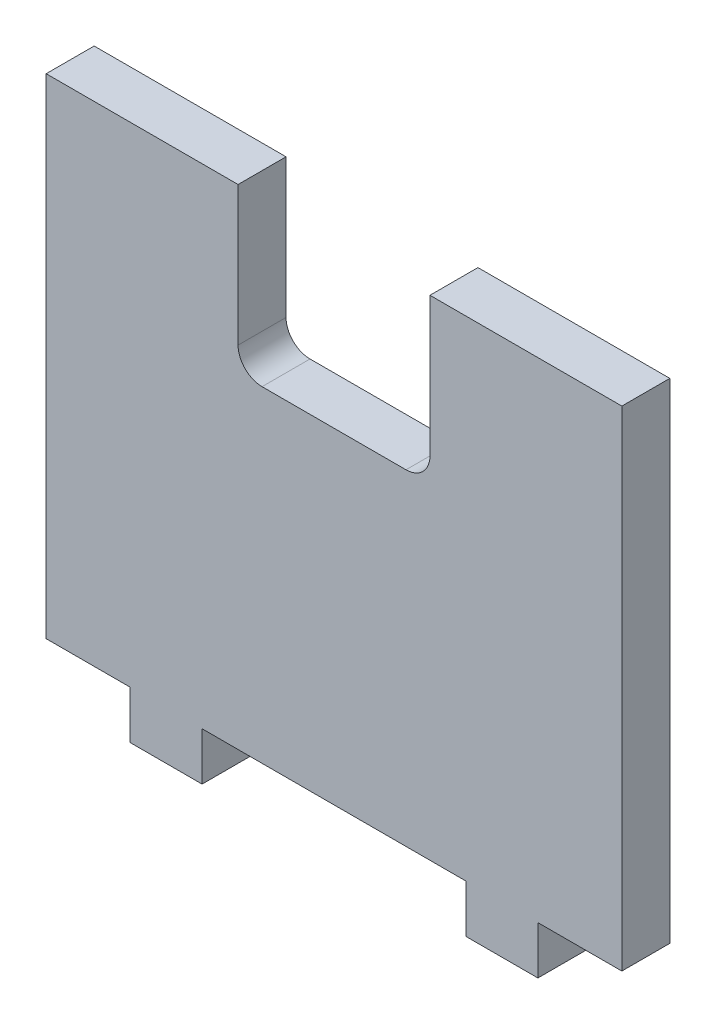
from build123d import *

# Parameters (mm, degrees)
EXTRUDE1_DEPTH     = 12.7
SKETCH2_W          = 50.8
SKETCH2_H          = 43.18
CUT_EXTRUDE1_DEPTH = 162.863978698
FILLET1_R          = 6.35


with BuildPart() as part:
    # Sketch1 → Extrude1 (new body)
    with BuildSketch(Plane.XY):
        Polygon((-76.2, 142.24), (76.2, 142.24), (76.2, 12.7), (53.975, 12.7), (53.975, 0), (34.925, 0), (34.925, 12.7), (-34.925, 12.7), (-34.925, 0), (-53.975, 0), (-53.975, 12.7), (-76.2, 12.7), align=None)
    extrude(amount=-EXTRUDE1_DEPTH)

    # Sketch2 → Cut-Extrude1 (cut, through all)
    with BuildSketch(Plane.XY):
        with Locations((0, 120.65)):
            Rectangle(SKETCH2_W, SKETCH2_H)
    extrude(amount=-CUT_EXTRUDE1_DEPTH, mode=Mode.SUBTRACT)

    # Fillet1
    fillet1_edges = [part.edges().sort_by_distance(p)[0] for p in [
        (-25.4, 99.06, -6.35),
        (25.4, 99.06, -6.35),
    ]]
    fillet(fillet1_edges, radius=FILLET1_R)


solid = part.part
